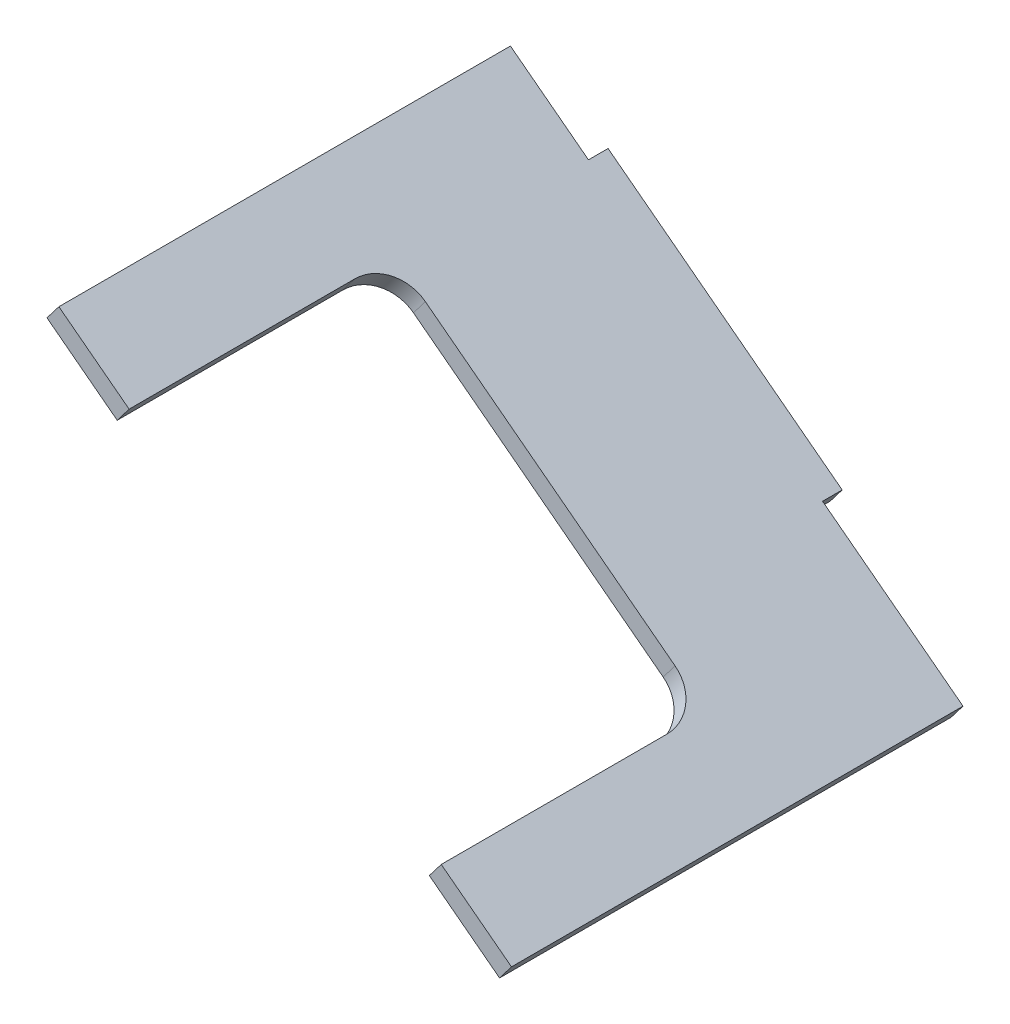
from build123d import *

# Parameters (mm, degrees)
ESTRUSIONE_ESTRUSIONE1_DEPTH      = 46
ESTRUSIONE_ESTRUSIONE1_DEPTH_BACK = 2
SCHIZZO2_W                        = 10
SCHIZZO2_H                        = 46
SCHIZZO2_W_2                      = 18
ESTRUSIONE_ESTRUSIONE2_DEPTH      = 2
SCHIZZO3_W                        = 40
SCHIZZO3_H                        = 27
TAGLIO_ESTRUSIONE1_DEPTH          = 10
RACCORDO1_R                       = 4


with BuildPart() as part:
    # Schizzo1 → Estrusione-Estrusione1 (new, two sides: drawn at the far end of the back side and taken through both)
    with BuildSketch(Plane.XY.offset(-ESTRUSIONE_ESTRUSIONE1_DEPTH_BACK)):
        Polygon((62.384284835, 50.597287007), (38.536156503, 68.79802257), (37.322774132, 67.208147347), (61.170902464, 49.007411784), align=None)
    extrude(amount=ESTRUSIONE_ESTRUSIONE1_DEPTH + ESTRUSIONE_ESTRUSIONE1_DEPTH_BACK)

    # Schizzo2 → Estrusione-Estrusione2 (add)
    with BuildSketch(Plane(origin=(46.150805657, 60.470651428, 0), x_dir=(0.7949376110826004, -0.606691185436453, 0), z_dir=(-0.606691185436453, -0.7949376110826004, 0))):
        with Locations((-16.105313678, 23)):
            Rectangle(SCHIZZO2_W, SCHIZZO2_H)
        with Locations((27.894686322, 23)):
            Rectangle(SCHIZZO2_W_2, SCHIZZO2_H)
    extrude(amount=-ESTRUSIONE_ESTRUSIONE2_DEPTH)

    # Schizzo3 → Taglio-Estrusione1 (cut)
    with BuildSketch(Plane(origin=(47.364188028, 62.06052665, 0), x_dir=(0.7949376110826014, -0.6066911854364516, 0), z_dir=(0.6066911854364516, 0.7949376110826014, 0))):
        with Locations((7.894686322, -32.5)):
            Rectangle(SCHIZZO3_W, SCHIZZO3_H)
    extrude(amount=-TAGLIO_ESTRUSIONE1_DEPTH, mode=Mode.SUBTRACT)

    # Raccordo1
    raccordo1_edges = [part.edges().sort_by_distance(p)[0] for p in [
        (37.134527706, 68.609776144, 19),
        (68.932032149, 44.342128727, 19),
    ]]
    fillet(raccordo1_edges, radius=RACCORDO1_R)


solid = part.part
